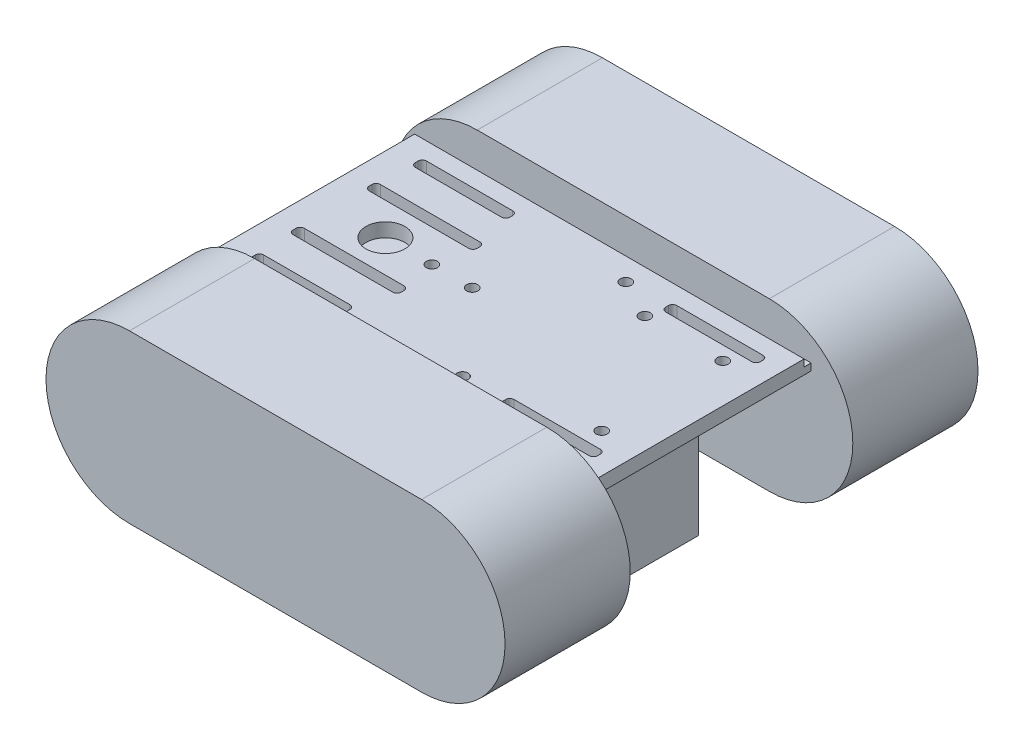
from build123d import *

# Parameters (mm, degrees)
BOSS_EXTRU_1_DEPTH      = 170
ESQUISSE2_W             = 206.92447976
ESQUISSE2_H             = 80
ENL_V_MAT_EXTRU_1_DEPTH = 170
ESQUISSE3_W             = 140
ESQUISSE3_H             = 2.5
BOSS_EXTRU_2_DEPTH      = 80
ESQUISSE4_W             = 140
ESQUISSE4_H             = 75
BOSS_EXTRU_4_DEPTH      = 2.5
ESQUISSE5_W             = 33
ESQUISSE5_H             = 40
BOSS_EXTRU_5_DEPTH      = 34
ESQUISSE6_R             = 7
ESQUISSE6_R_2           = 2
ENL_V_MAT_EXTRU_2_DEPTH = 5


with BuildPart() as part:
    # Esquisse1 → Boss.-Extru.1 (new body)
    with BuildSketch(Plane.XY):
        with BuildLine():
            Line((0, 30), (105, 30))
            ThreePointArc((105, 30), (135, 0), (105, -30))
            Line((105, -30), (0, -30))
            ThreePointArc((0, -30), (-30, 0), (0, 30))
        make_face()
    extrude(amount=BOSS_EXTRU_1_DEPTH)

    # Esquisse2 → Enlèv. mat.-Extru.1 (cut)
    with BuildSketch(Plane(origin=(0, 30, 0), x_dir=(1, 0, 0), z_dir=(0, 1, 0))):
        with Locations((42.57058543, -85)):
            Rectangle(ESQUISSE2_W, ESQUISSE2_H)
    extrude(amount=-ENL_V_MAT_EXTRU_1_DEPTH, mode=Mode.SUBTRACT)


with BuildPart() as enl_v_mat_extru_1_piece_1:
    # of the separate pieces the step leaves, piece 1, a body of its own (enl_v_mat_extru_1_pieces)
    add(part.part.solids().sort_by_distance((105, -30, 0))[0])



with BuildPart() as enl_v_mat_extru_1_piece_2:
    # of the separate pieces the step leaves, piece 2, a body of its own (enl_v_mat_extru_1_pieces)
    add(part.part.solids().sort_by_distance((0, -30, 125))[0])


with BuildPart() as enl_v_mat_extru_1_piece_1_1:
    add(enl_v_mat_extru_1_piece_1.part)

    add(enl_v_mat_extru_1_piece_2.part)  # Boss.-Extru.2 merges Enlèv. mat.-Extru.1 piece 2
    # Esquisse3 → Boss.-Extru.2 (add)
    with BuildSketch(Plane.XY.offset(45)):
        with Locations((50, 16.25)):
            Rectangle(ESQUISSE3_W, ESQUISSE3_H)
    extrude(amount=BOSS_EXTRU_2_DEPTH)

    # Esquisse4 → Boss.-Extru.4 (add)
    with BuildSketch(Plane(origin=(0, 17.5, 0), x_dir=(1, 0, 0), z_dir=(0, 1, 0))):
        with Locations((50, -85)):
            Rectangle(ESQUISSE4_W, ESQUISSE4_H)
    extrude(amount=BOSS_EXTRU_4_DEPTH)

    # Esquisse5 → Boss.-Extru.5 (add)
    with BuildSketch(Plane.XZ.offset(-15)):
        with Locations((-0.5, 67.5)):
            Rectangle(ESQUISSE5_W, ESQUISSE5_H)
        with Locations((100.5, 102.5)):
            Rectangle(ESQUISSE5_W, ESQUISSE5_H)
    extrude(amount=BOSS_EXTRU_5_DEPTH)

    # Esquisse6 → Enlèv. mat.-Extru.2 (cut)
    with BuildSketch(Plane(origin=(0, 20, 0), x_dir=(1, 0, 0), z_dir=(0, 1, 0))):
        with Locations(Location((7, -85, 0), (0, 0, 180))):
            Circle(ESQUISSE6_R)
        with Locations(Location((23.7, -85, 0), (0, 0, 180))):
            Circle(ESQUISSE6_R_2)
        with Locations(Location((38.2, -85, 0), (0, 0, 180))):
            Circle(ESQUISSE6_R_2)
        with Locations(Location((64, -114.25, 0), (0, 0, 180))):
            Circle(ESQUISSE6_R_2)
        with Locations(Location((64, -55.616071429, 0), (0, 0, 180))):
            Circle(ESQUISSE6_R_2)
        with Locations(Location((78, -62.75, 0), (0, 0, 180))):
            Circle(ESQUISSE6_R_2)
        with Locations(Location((106, -62.75, 0), (0, 0, 180))):
            Circle(ESQUISSE6_R_2)
        with Locations(Location((106, -106.25, 0), (0, 0, 180))):
            Circle(ESQUISSE6_R_2)
        with BuildLine():
            Line((-9.5, -53.75), (21.5, -53.75))
            ThreePointArc((21.5, -53.75), (22.560660172, -54.189339828), (23, -55.25))
            Line((23, -55.25), (23, -56.25))
            ThreePointArc((23, -56.25), (22.560660172, -57.310660172), (21.5, -57.75))
            Line((21.5, -57.75), (-9.5, -57.75))
            ThreePointArc((-9.5, -57.75), (-10.560660172, -57.310660172), (-11, -56.25))
            Line((-11, -56.25), (-11, -55.25))
            ThreePointArc((-11, -55.25), (-10.560660172, -54.189339828), (-9.5, -53.75))
        make_face()
        with BuildLine():
            Line((-10.5, -69.35), (25.3, -69.35))
            ThreePointArc((25.3, -69.35), (26.360660172, -69.789339828), (26.8, -70.85))
            Line((26.8, -70.85), (26.8, -71.85))
            ThreePointArc((26.8, -71.85), (26.360660172, -72.910660172), (25.3, -73.35))
            Line((25.3, -73.35), (-10.5, -73.35))
            ThreePointArc((-10.5, -73.35), (-11.560660172, -72.910660172), (-12, -71.85))
            Line((-12, -71.85), (-12, -70.85))
            ThreePointArc((-12, -70.85), (-11.560660172, -69.789339828), (-10.5, -69.35))
        make_face()
        with BuildLine():
            Line((-10.5, -96.65), (25.3, -96.65))
            ThreePointArc((25.3, -96.65), (26.360660172, -97.089339828), (26.8, -98.15))
            Line((26.8, -98.15), (26.8, -99.15))
            ThreePointArc((26.8, -99.15), (26.360660172, -100.210660172), (25.3, -100.65))
            Line((25.3, -100.65), (-10.5, -100.65))
            ThreePointArc((-10.5, -100.65), (-11.560660172, -100.210660172), (-12, -99.15))
            Line((-12, -99.15), (-12, -98.15))
            ThreePointArc((-12, -98.15), (-11.560660172, -97.089339828), (-10.5, -96.65))
        make_face()
        with BuildLine():
            Line((-9.5, -112.25), (21.5, -112.25))
            ThreePointArc((21.5, -112.25), (22.560660172, -112.689339828), (23, -113.75))
            Line((23, -113.75), (23, -114.75))
            ThreePointArc((23, -114.75), (22.560660172, -115.810660172), (21.5, -116.25))
            Line((21.5, -116.25), (-9.5, -116.25))
            ThreePointArc((-9.5, -116.25), (-10.560660172, -115.810660172), (-11, -114.75))
            Line((-11, -114.75), (-11, -113.75))
            ThreePointArc((-11, -113.75), (-10.560660172, -112.689339828), (-9.5, -112.25))
        make_face()
        with BuildLine():
            Line((111.5, -53.75), (80.5, -53.75))
            ThreePointArc((80.5, -53.75), (79.439339828, -54.189339828), (79, -55.25))
            Line((79, -55.25), (79, -56.25))
            ThreePointArc((79, -56.25), (79.439339828, -57.310660172), (80.5, -57.75))
            Line((80.5, -57.75), (111.5, -57.75))
            ThreePointArc((111.5, -57.75), (112.560660172, -57.310660172), (113, -56.25))
            Line((113, -56.25), (113, -55.25))
            ThreePointArc((113, -55.25), (112.560660172, -54.189339828), (111.5, -53.75))
        make_face()
        with BuildLine():
            Line((80.5, -116.25), (111.5, -116.25))
            ThreePointArc((111.5, -116.25), (112.560660172, -115.810660172), (113, -114.75))
            Line((113, -114.75), (113, -113.75))
            ThreePointArc((113, -113.75), (112.560660172, -112.689339828), (111.5, -112.25))
            Line((111.5, -112.25), (80.5, -112.25))
            ThreePointArc((80.5, -112.25), (79.439339828, -112.689339828), (79, -113.75))
            Line((79, -113.75), (79, -114.75))
            ThreePointArc((79, -114.75), (79.439339828, -115.810660172), (80.5, -116.25))
        make_face()
    extrude(amount=-ENL_V_MAT_EXTRU_2_DEPTH, mode=Mode.SUBTRACT)


solid = enl_v_mat_extru_1_piece_1_1.part
